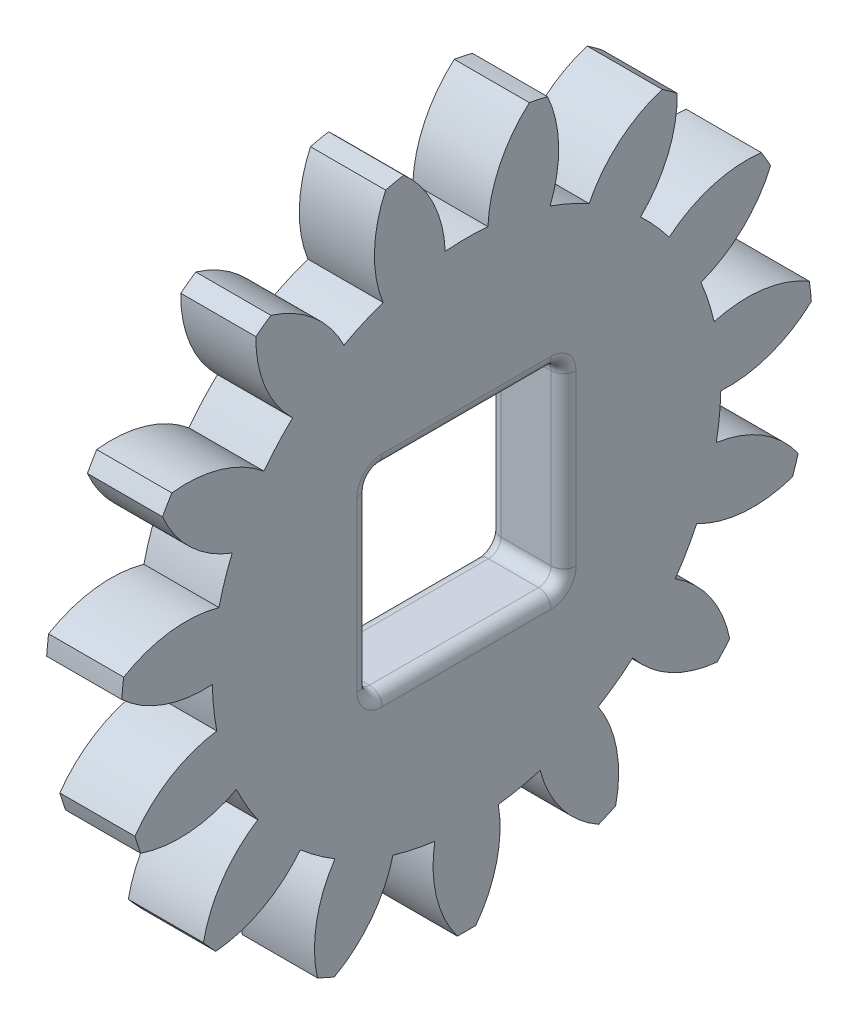
from build123d import *

# Parameters (mm, degrees)
BASPROSKE_W        = 12
BASPROSKE_H        = 55.25
TOOTHCUT_DEPTH     = 80.051407325
TEETHCUTS_COUNT    = 15
TEETHCUTS_ANGLE    = 336
BORSKE_R           = 10
BORE_DEPTH         = 50.0000508
SKETCH1_W          = 31
SKETCH1_H          = 31
CUT_EXTRUDE2_DEPTH = 79.934396957
FILLET1_R          = 2


with BuildPart() as part:
    # BasProSke → Base-Revolve (revolve)
    with BuildSketch(Plane(origin=(0, 0, 0), x_dir=(1, 0, 0), z_dir=(0, 1, 0)), mode=Mode.PRIVATE) as base_revolve_sk:
        with Locations((6, 27.625)):
            Rectangle(BASPROSKE_W, BASPROSKE_H)
    revolve(base_revolve_sk.sketch.rotate(Axis((-10, 0, 0), (1, 0, 0)), 180), axis=Axis((-10, 0, 0), (1, 0, 0)))

    # TooCutSke → ToothCut (cut, through all)
    with BuildSketch(Plane(origin=(0, 0, 0), x_dir=(0, 0, -1), z_dir=(1, 0, 0))):
        with BuildLine():
            ThreePointArc((3.414601006, 40.480240562), (0, 40.624), (-3.414601006, 40.480240562))
            ThreePointArc((-3.414601006, 40.480240562), (-5.310758866, 48.09911095), (-10.058002941, 54.352611915))
            ThreePointArc((-10.058002941, 54.352611915), (0, 55.2754), (10.058002941, 54.352611915))
            ThreePointArc((10.058002941, 54.352611915), (5.310758866, 48.09911095), (3.414601006, 40.480240562))
        make_face()
    toothcut = extrude(amount=TOOTHCUT_DEPTH, mode=Mode.SUBTRACT)

    # TeethCuts: ToothCut ×15 about axis
    teethcuts_axis = Axis((-10, 0, 0), (1, 0, 0))
    for i in range(1, TEETHCUTS_COUNT):
        add(toothcut.rotate(teethcuts_axis, i * TEETHCUTS_ANGLE / (TEETHCUTS_COUNT - 1)), mode=Mode.SUBTRACT)

    # BorSke → Bore (cut, symmetric)
    with BuildSketch(Plane(origin=(0, 0, 0), x_dir=(0, 0, -1), z_dir=(1, 0, 0))):
        with Locations(Location((0, 0, 0), (0, 0, 180))):
            Circle(BORSKE_R)
    extrude(amount=BORE_DEPTH, both=True, mode=Mode.SUBTRACT)

    # Sketch1 → Cut-Extrude2 (cut, through all)
    with BuildSketch(Plane(origin=(12, 0, 0), x_dir=(0, 0, -1), z_dir=(1, 0, 0))):
        Rectangle(SKETCH1_W, SKETCH1_H)
    extrude(amount=-CUT_EXTRUDE2_DEPTH, mode=Mode.SUBTRACT)

    # Fillet1
    fillet1_edges = [part.edges().sort_by_distance(p)[0] for p in [
        (0, 0, -15.5),
        (6, 15.5, -15.5),
        (0, -15.5, 0),
        (6, -15.5, -15.5),
        (0, 0, 15.5),
        (6, -15.5, 15.5),
        (0, 15.5, 0),
        (6, 15.5, 15.5),
        (12, 0, -15.5),
        (12, 15.5, 0),
        (12, 0, 15.5),
        (12, -15.5, 0),
    ]]
    fillet(fillet1_edges, radius=FILLET1_R)


solid = part.part
